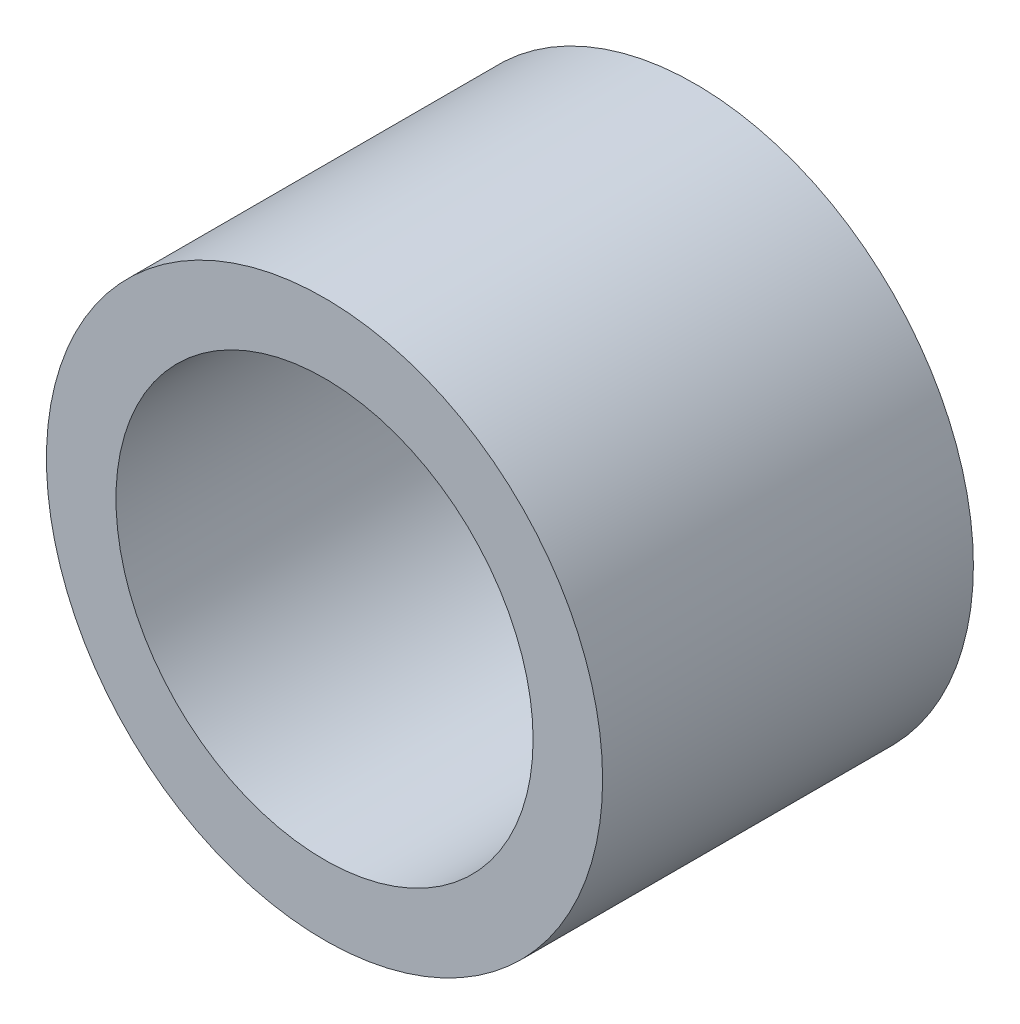
from build123d import *

# Parameters (mm, degrees)
ESQUISSE1_R        = 6
ESQUISSE1_R_2      = 4.5
BOSS_EXTRU_1_DEPTH = 4


with BuildPart() as part:
    # Esquisse1 → Boss.-Extru.1 (new, symmetric)
    with BuildSketch(Plane.XY):
        Circle(ESQUISSE1_R)
        Circle(ESQUISSE1_R_2, mode=Mode.SUBTRACT)
    extrude(amount=BOSS_EXTRU_1_DEPTH, both=True)


solid = part.part
